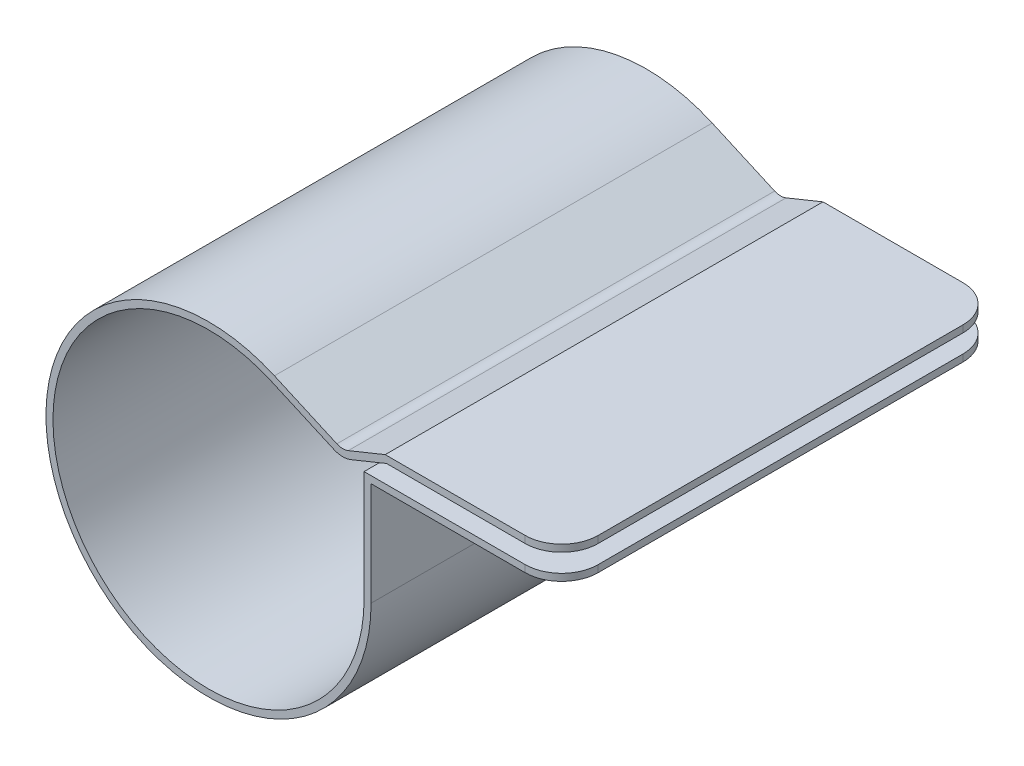
from build123d import *

# Parameters (mm, degrees)
BOSS_EXTRUDE1_DEPTH = 76.2
FILLET2_R           = 6.35


with BuildPart() as part:
    # Sketch2 → Boss-Extrude1 (new body)
    with BuildSketch(Plane.XY):
        with BuildLine():
            Line((61.468, 23.62454), (30.749865701, 23.62454))
            Line((30.749865701, 23.62454), (24.323763897, 21.014679926))
            ThreePointArc((24.323763897, 21.014679926), (23.327763264, 20.82831872), (22.338166155, 21.046138193))
            Line((22.338166155, 21.046138193), (11.472349033, 25.865540532))
            ThreePointArc((11.472349033, 25.865540532), (-23.719801629, -15.427637215), (28.2956, 0))
            Line((28.2956, 0), (28.2956, 18.01114))
            Line((28.2956, 18.01114), (61.468, 18.01114))
            Line((61.468, 18.01114), (61.468, 19.23034))
            Line((61.468, 19.23034), (27.0764, 19.23034))
            Line((27.0764, 19.23034), (27.0764, 0))
            ThreePointArc((27.0764, 0), (-22.697763498, -14.762891626), (10.978028787, 24.751046865))
            Line((10.978028787, 24.751046865), (21.843845909, 19.931644525))
            ThreePointArc((21.843845909, 19.931644525), (23.308449631, 19.609271705), (24.782530568, 19.88508629))
            Line((24.782530568, 19.88508629), (30.988, 22.40534))
            Line((30.988, 22.40534), (61.468, 22.40534))
            Line((61.468, 22.40534), (61.468, 23.62454))
        make_face()
    extrude(amount=BOSS_EXTRUDE1_DEPTH)

    # Fillet2
    fillet2_edges = [part.edges().sort_by_distance(p)[0] for p in [
        (61.468, 23.01494, 76.2),
        (61.468, 18.62074, 0),
        (61.468, 23.01494, 0),
        (61.468, 18.62074, 76.2),
    ]]
    fillet(fillet2_edges, radius=FILLET2_R)


solid = part.part
